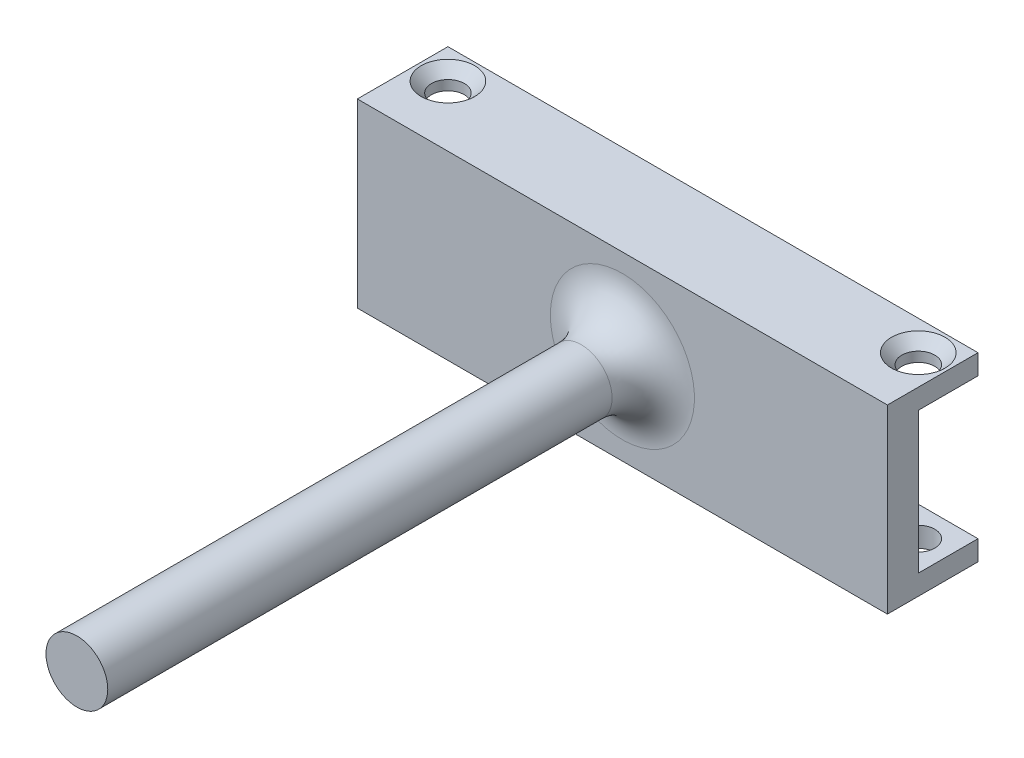
from build123d import *

# Parameters (mm, degrees)
SKETCH1_W           = 51.5
SKETCH1_H           = 17.6
BOSS_EXTRUDE1_DEPTH = 8.8
SKETCH2_W           = 51.5
SKETCH2_H           = 13.7
CUT_EXTRUDE1_DEPTH  = 5.8
SKETCH3_R           = 1.6
CUT_EXTRUDE2_DEPTH  = 17.8
CHAMFER1_SIZE       = 1
SKETCH4_R           = 3
BOSS_EXTRUDE2_DEPTH = 53
FILLET1_R           = 4


with BuildPart() as part:
    # Sketch1 → Boss-Extrude1 (new body)
    with BuildSketch(Plane.XY):
        with Locations((25.75, 8.8)):
            Rectangle(SKETCH1_W, SKETCH1_H)
    extrude(amount=BOSS_EXTRUDE1_DEPTH)

    # Sketch2 → Cut-Extrude1 (cut)
    with BuildSketch(Plane(origin=(0, 0, 0), x_dir=(-1, 0, 0), z_dir=(0, 0, -1))):
        with Locations((-25.75, 8.8)):
            Rectangle(SKETCH2_W, SKETCH2_H)
    extrude(amount=-CUT_EXTRUDE1_DEPTH, mode=Mode.SUBTRACT)

    # Sketch3 → Cut-Extrude2 (cut)
    with BuildSketch(Plane(origin=(0, 17.6, 0), x_dir=(1, 0, 0), z_dir=(0, 1, 0))):
        with Locations(Location((2.9, -2.9, 0), (0, 0, 270))):
            Circle(SKETCH3_R)
        with Locations(Location((48.6, -2.9, 0), (0, 0, 270))):
            Circle(SKETCH3_R)
    extrude(amount=-CUT_EXTRUDE2_DEPTH, mode=Mode.SUBTRACT)

    # Chamfer1
    chamfer1_edges = [part.edges().sort_by_distance(p)[0] for p in [
        (2.9, 17.6, 1.3),
        (48.6, 17.6, 1.3),
    ]]
    chamfer(chamfer1_edges, length=CHAMFER1_SIZE)

    # Sketch4 → Boss-Extrude2 (add)
    with BuildSketch(Plane.XY.offset(8.8)):
        with Locations(Location((25.75, 8.8, 0), (0, 0, 180))):
            Circle(SKETCH4_R)
    extrude(amount=BOSS_EXTRUDE2_DEPTH)

    # Fillet1
    fillet1_edges = [part.edges().sort_by_distance(p)[0] for p in [
        (28.75, 8.8, 8.8),
    ]]
    fillet(fillet1_edges, radius=FILLET1_R)


solid = part.part
